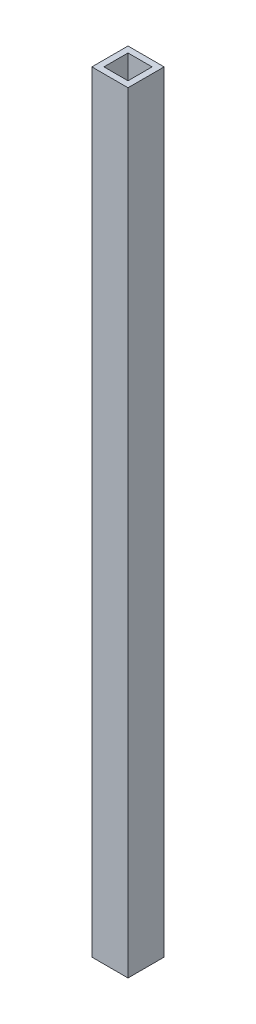
from build123d import *

# Parameters (mm, degrees)
SKETCH1_W           = 19.05
SKETCH1_H           = 19.05
BOSS_EXTRUDE1_DEPTH = 406.4
SKETCH2_W           = 12.7
SKETCH2_H           = 12.7
CUT_EXTRUDE1_DEPTH  = 406.4


with BuildPart() as part:
    # Sketch1 → Boss-Extrude1 (new body)
    with BuildSketch(Plane(origin=(0, 0, 0), x_dir=(1, 0, 0), z_dir=(0, 1, 0))):
        with Locations((9.525, 9.525)):
            Rectangle(SKETCH1_W, SKETCH1_H)
    extrude(amount=BOSS_EXTRUDE1_DEPTH)

    # Sketch2 → Cut-Extrude1 (cut)
    with BuildSketch(Plane(origin=(0, 406.4, 0), x_dir=(1, 0, 0), z_dir=(0, 1, 0))):
        with Locations((9.525, 9.525)):
            Rectangle(SKETCH2_W, SKETCH2_H)
    extrude(amount=-CUT_EXTRUDE1_DEPTH, mode=Mode.SUBTRACT)


solid = part.part
